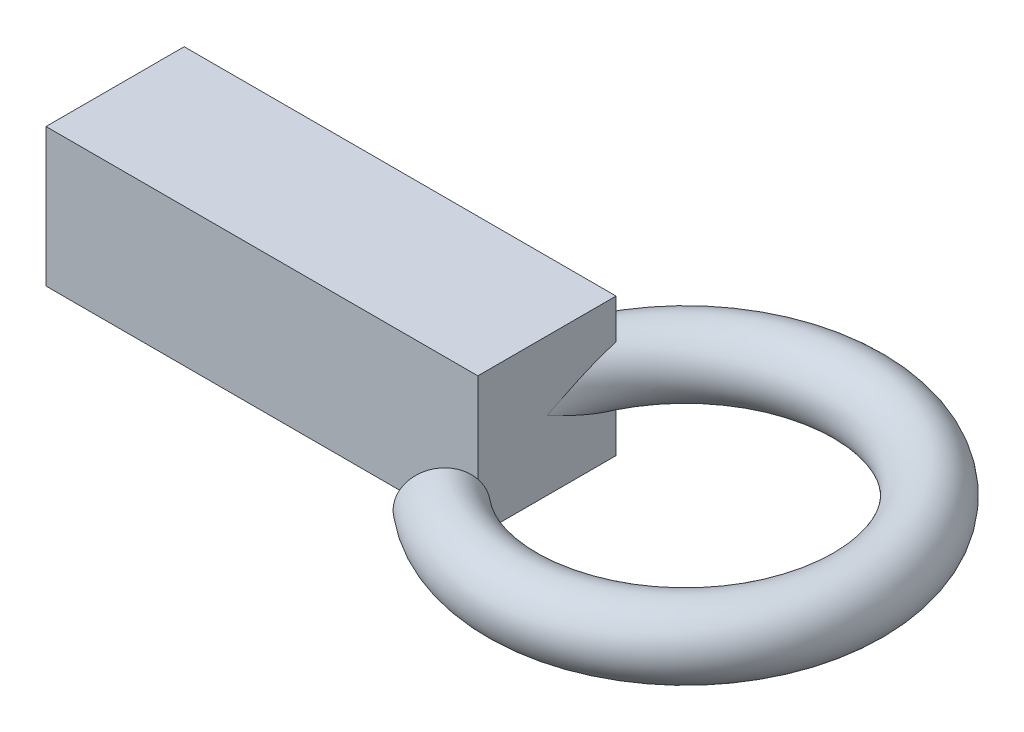
from build123d import *

# Parameters (mm, degrees)
SKETCH2_R             = 4
SKETCH3_W             = 50
SKETCH3_H             = 16
BOSS_EXTRUDE1_DEPTH   = 8
M8_TAPPED_HOLE1_D     = 6.8
M8_TAPPED_HOLE1_DEPTH = 30
M8_TAPPED_HOLE1_TIP   = 2.042926105


with BuildPart() as part:
    # Sweep1: sweep along a path in Sketch1
    with BuildLine(Plane(origin=(0, 0, 0), x_dir=(1, 0, 0), z_dir=(0, 1, 0))) as sweep1_path:
        ThreePointArc((7.144247806, -15.320888862), (38.126155741, 8.452365235), (0, 0))
    # Sketch2 → Sweep1 (sweep)
    with BuildSketch(Plane.XY):
        Circle(SKETCH2_R)
    sweep(path=sweep1_path.line)

    # Sketch3 → Boss-Extrude1 (add, symmetric)
    with BuildSketch(Plane(origin=(0, 0, 0), x_dir=(1, 0, 0), z_dir=(0, 1, 0))):
        with Locations((-21, 0)):
            Rectangle(SKETCH3_W, SKETCH3_H)
    extrude(amount=BOSS_EXTRUDE1_DEPTH, both=True)

    # M8 Tapped Hole1
    with Locations(Plane.ZY.offset(46)):
        with Locations((0, 0)):
            Hole(M8_TAPPED_HOLE1_D / 2, depth=M8_TAPPED_HOLE1_DEPTH)
            with Locations((0, 0, -(M8_TAPPED_HOLE1_DEPTH + M8_TAPPED_HOLE1_TIP / 2))):  # 118° drill point
                Cone(0, M8_TAPPED_HOLE1_D / 2, M8_TAPPED_HOLE1_TIP, mode=Mode.SUBTRACT)


solid = part.part
